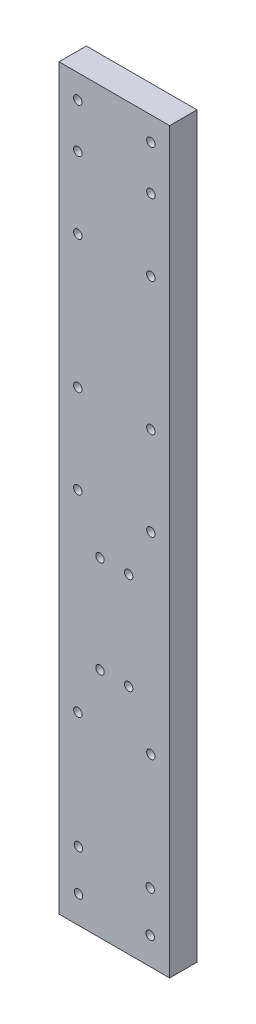
from build123d import *

# Parameters (mm, degrees)
SKETCH1_W           = 16.2
SKETCH1_H           = 108.14
SKETCH1_R           = 0.62
BOSS_EXTRUDE1_DEPTH = 4


with BuildPart() as part:
    # Sketch1 → Boss-Extrude1 (new body)
    with BuildSketch(Plane.XY):
        with Locations((8.1, 54.07)):
            Rectangle(SKETCH1_W, SKETCH1_H)
        with Locations((13.45, 55.21)):
            Circle(SKETCH1_R, mode=Mode.SUBTRACT)
        with Locations((10.2, 48.21)):
            Circle(SKETCH1_R, mode=Mode.SUBTRACT)
        with Locations(Location((13.45, 104.66, 0), (0, 0, 180))):
            Circle(SKETCH1_R, mode=Mode.SUBTRACT)
        with Locations((2.75, 98.16)):
            Circle(SKETCH1_R, mode=Mode.SUBTRACT)
        with Locations((6, 48.21)):
            Circle(SKETCH1_R, mode=Mode.SUBTRACT)
        with Locations((2.75, 27)):
            Circle(SKETCH1_R, mode=Mode.SUBTRACT)
        with Locations(Location((2.75, 87.66, 0), (0, 0, 180))):
            Circle(SKETCH1_R, mode=Mode.SUBTRACT)
        with Locations((2.75, 55.21)):
            Circle(SKETCH1_R, mode=Mode.SUBTRACT)
        with Locations(Location((13.45, 87.66, 0), (0, 0, 180))):
            Circle(SKETCH1_R, mode=Mode.SUBTRACT)
        with Locations(Location((13.45, 98.16, 0), (0, 0, 180))):
            Circle(SKETCH1_R, mode=Mode.SUBTRACT)
        with Locations((13.45, 68.21)):
            Circle(SKETCH1_R, mode=Mode.SUBTRACT)
        with Locations((6, 34)):
            Circle(SKETCH1_R, mode=Mode.SUBTRACT)
        with Locations((2.75, 104.66)):
            Circle(SKETCH1_R, mode=Mode.SUBTRACT)
        with Locations((10.2, 34)):
            Circle(SKETCH1_R, mode=Mode.SUBTRACT)
        with Locations((2.75, 68.21)):
            Circle(SKETCH1_R, mode=Mode.SUBTRACT)
        with Locations((13.45, 27)):
            Circle(SKETCH1_R, mode=Mode.SUBTRACT)
        with Locations((2.85, 10)):
            Circle(SKETCH1_R, mode=Mode.SUBTRACT)
        with Locations(Location((13.35, 10, 0), (0, 0, 180))):
            Circle(SKETCH1_R, mode=Mode.SUBTRACT)
        with Locations(Location((13.35, 4, 0), (0, 0, 180))):
            Circle(SKETCH1_R, mode=Mode.SUBTRACT)
        with Locations((2.85, 4)):
            Circle(SKETCH1_R, mode=Mode.SUBTRACT)
    extrude(amount=BOSS_EXTRUDE1_DEPTH)


solid = part.part
